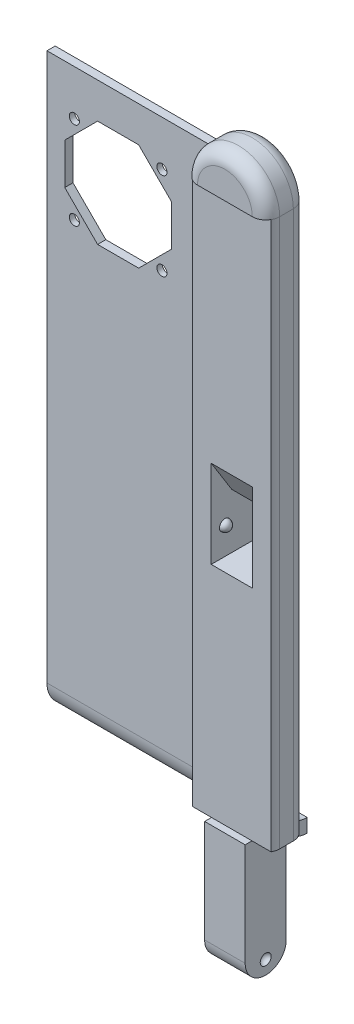
from build123d import *

# Parameters (mm, degrees)
BOSS_EXTRUDE1_DEPTH = 7.5
FILLET1_R           = 5
SKETCH2_W           = 15
SKETCH2_H           = 20
CUT_EXTRUDE1_DEPTH  = 152.492574075
FILLET6_R           = 5
CUT_EXTRUDE2_DEPTH  = 152.848641746
BOSS_EXTRUDE2_DEPTH = 80
BOSS_EXTRUDE3_START = 5
BOSS_EXTRUDE3_DEPTH = 5
SKETCH12_W          = 12.5
SKETCH12_H          = 20
CUT_EXTRUDE3_DEPTH  = 3
SKETCH13_W          = 2.5
SKETCH13_H          = 200
CUT_EXTRUDE4_DEPTH  = 160.863222787
SKETCH14_R          = 1.85
CUT_EXTRUDE5_DEPTH  = 10
SKETCH15_R          = 3.25
CUT_EXTRUDE6_DEPTH  = 1
CUT_EXTRUDE7_DEPTH  = 7.5


with BuildPart() as part:
    # Sketch1 → Boss-Extrude1 (new, symmetric)
    with BuildSketch(Plane.XY):
        with BuildLine():
            Line((-15, 100), (-15, -100))
            Line((-15, -100), (-7.4, -100))
            Line((-7.4, -100), (-7.4, -150))
            Line((-7.4, -150), (7.4, -150))
            Line((7.4, -150), (7.4, -100))
            Line((7.4, -100), (15, -100))
            Line((15, -100), (15, 100))
            ThreePointArc((15, 100), (0, 115), (-15, 100))
        make_face()
    extrude(amount=BOSS_EXTRUDE1_DEPTH, both=True)

    # Fillet1
    fillet1_edges = [part.edges().sort_by_distance(p)[0] for p in [
        (-15, 0, -7.5),
        (0, 115, -7.5),
        (15, 0, 7.5),
        (0, 115, 7.5),
        (15, 0, -7.5),
        (-15, 0, 7.5),
    ]]
    fillet(fillet1_edges, radius=FILLET1_R)

    # Sketch2 → Cut-Extrude1 (cut, through all)
    with BuildSketch(Plane.XY.offset(7.5)):
        with Locations((0, -10)):
            Rectangle(SKETCH2_W, SKETCH2_H)
    extrude(amount=-CUT_EXTRUDE1_DEPTH, mode=Mode.SUBTRACT)

    # Sketch5 → Cut-Revolve1 (revolve, cut)
    with BuildSketch(Plane.XY):
        with BuildLine():
            Line((-7.4, -140), (-5.4, -140))
            ThreePointArc((-5.4, -140), (-5.985786438, -138.585786438), (-7.4, -138))
            Line((-7.4, -138), (-7.4, -140))
        make_face()
        with BuildLine():
            Line((7.4, -140), (5.4, -140))
            ThreePointArc((5.4, -140), (5.985786438, -138.585786438), (7.4, -138))
            Line((7.4, -138), (7.4, -140))
        make_face()
    revolve(axis=Axis((-35.580304025, -140, 0), (1, 0, 0)), mode=Mode.SUBTRACT)

    # Fillet6
    fillet6_edges = [part.edges().sort_by_distance(p)[0] for p in [
        (7.4, -150, 0),
        (-7.4, -150, 0),
    ]]
    fillet(fillet6_edges, radius=FILLET6_R)

    # Sketch7 → Cut-Extrude2 (cut, through all)
    with BuildSketch(Plane(origin=(7.4, 0, 0), x_dir=(0, 0, -1), z_dir=(1, 0, 0))):
        with BuildLine():
            Line((-7.5, -137.5), (-7.5, -150))
            Line((-7.5, -150), (7.5, -150))
            Line((7.5, -150), (7.5, -137.5))
            ThreePointArc((7.5, -137.5), (0, -145), (-7.5, -137.5))
        make_face()
    extrude(amount=-CUT_EXTRUDE2_DEPTH, mode=Mode.SUBTRACT)

    # Sketch9 → Revolve2 (revolve)
    with BuildSketch(Plane.XY):
        with BuildLine():
            Line((-7.5, -10), (-5.5, -10))
            ThreePointArc((-5.5, -10), (-6.085786438, -8.585786438), (-7.5, -8))
            Line((-7.5, -8), (-7.5, -10))
        make_face()
        with BuildLine():
            Line((7.5, -10), (5.5, -10))
            ThreePointArc((5.5, -10), (6.085786438, -8.585786438), (7.5, -8))
            Line((7.5, -8), (7.5, -10))
        make_face()
    revolve(axis=Axis((-32.251262552, -10, 0), (1, 0, 0)))

    # Sketch10 → Boss-Extrude2 (add)
    with BuildSketch(Plane(origin=(0, 0, 0), x_dir=(0, 0, -1), z_dir=(1, 0, 0))):
        with BuildLine():
            Line((7.5, -100), (7.5, 100))
            Line((7.5, 100), (10.5, 100))
            Line((10.5, 100), (10.5, -98.519259302))
            ThreePointArc((10.5, -98.519259302), (12.584119567, -103.288955309), (17.5, -105))
            Line((17.5, -105), (17.5, -110))
            ThreePointArc((17.5, -110), (10.428932188, -107.071067812), (7.5, -100))
        make_face()
    extrude(amount=-BOSS_EXTRUDE2_DEPTH)

    # Sketch11 → Boss-Extrude3 (add)
    with BuildSketch(Plane(origin=(0, 0, 0), x_dir=(0, 0, -1), z_dir=(1, 0, 0)).offset(BOSS_EXTRUDE3_START)):
        with BuildLine():
            Line((17.5, -110), (17.5, -105))
            ThreePointArc((17.5, -105), (12.584119567, -103.288955309), (10.5, -98.519259302))
            Line((10.5, -98.519259302), (10.5, 100))
            Line((10.5, 100), (7.5, 100))
            Line((7.5, 100), (7.5, -100))
            ThreePointArc((7.5, -100), (10.428932188, -107.071067812), (17.5, -110))
        make_face()
    extrude(amount=-BOSS_EXTRUDE3_DEPTH)

    # Sketch12 → Cut-Extrude3 (cut)
    with BuildSketch(Plane(origin=(0, 0, -10.5), x_dir=(-1, 0, 0), z_dir=(0, 0, -1))):
        with Locations((1.25, -10)):
            Rectangle(SKETCH12_W, SKETCH12_H)
    extrude(amount=-CUT_EXTRUDE3_DEPTH, mode=Mode.SUBTRACT)

    # Sketch13 → Cut-Extrude4 (cut, through all)
    with BuildSketch(Plane.ZY.offset(15)):
        with Locations((6.25, 0)):
            Rectangle(SKETCH13_W, SKETCH13_H)
    extrude(amount=-CUT_EXTRUDE4_DEPTH, mode=Mode.SUBTRACT)

    # Sketch14 → Cut-Extrude5 (cut)
    with BuildSketch(Plane(origin=(0, 0, -10.5), x_dir=(-1, 0, 0), z_dir=(0, 0, -1))):
        with Locations(Location((70, 51.480740698, 0), (0, 0, 90))):
            Circle(SKETCH14_R)
        with Locations(Location((70, 83.480740698, 0), (0, 0, 90))):
            Circle(SKETCH14_R)
        with Locations(Location((38, 83.480740698, 0), (0, 0, 90))):
            Circle(SKETCH14_R)
        with Locations(Location((38, 51.480740698, 0), (0, 0, 90))):
            Circle(SKETCH14_R)
        Polygon((61.5, 86.980740698), (46.5, 86.980740698), (34.5, 74.980740698), (34.5, 59.980740698), (46.5, 47.980740698), (61.5, 47.980740698), (73.5, 59.980740698), (73.5, 74.980740698), align=None)
    extrude(amount=-CUT_EXTRUDE5_DEPTH, mode=Mode.SUBTRACT)

    # Sketch15 → Cut-Extrude6 (cut)
    with BuildSketch(Plane(origin=(0, 0, -10.5), x_dir=(-1, 0, 0), z_dir=(0, 0, -1))):
        with Locations(Location((70, 83.480740698, 0), (0, 0, 90))):
            Circle(SKETCH15_R)
        with Locations(Location((38, 83.480740698, 0), (0, 0, 90))):
            Circle(SKETCH15_R)
        with Locations(Location((38, 51.480740698, 0), (0, 0, 90))):
            Circle(SKETCH15_R)
        with Locations(Location((70, 51.480740698, 0), (0, 0, 90))):
            Circle(SKETCH15_R)
    extrude(amount=-CUT_EXTRUDE6_DEPTH, mode=Mode.SUBTRACT)

    # Sketch16 → Cut-Extrude7 (cut, symmetric)
    with BuildSketch(Plane(origin=(0, 0, 0), x_dir=(0, 0, -1), z_dir=(1, 0, 0))):
        Polygon((2.5, 0), (-5, 12), (-5, 0), align=None)
    extrude(amount=CUT_EXTRUDE7_DEPTH, both=True, mode=Mode.SUBTRACT)


solid = part.part
